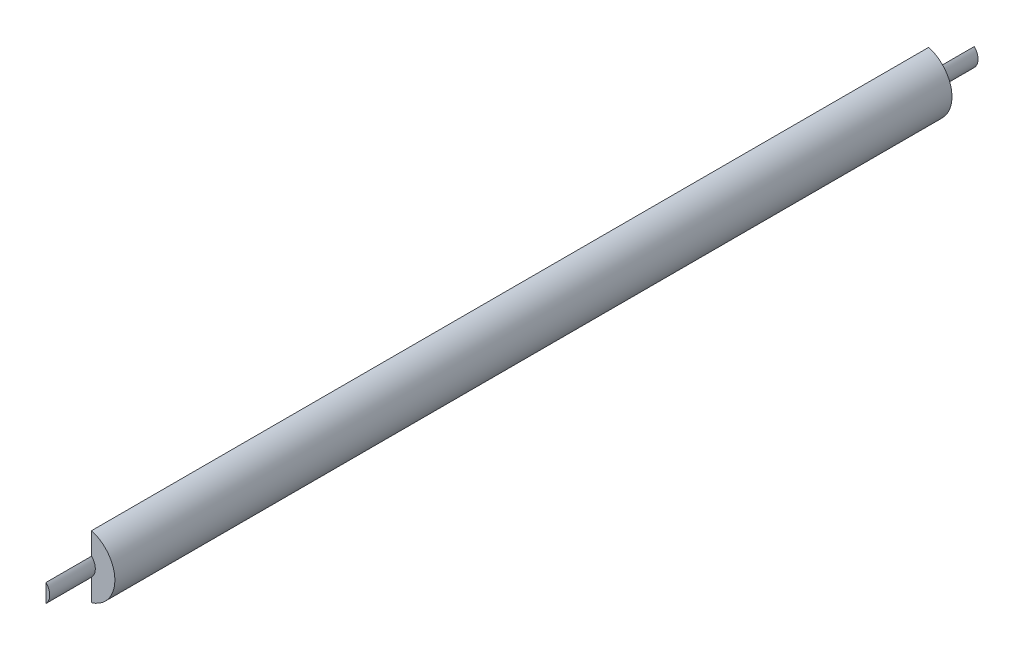
from build123d import *

# Parameters (mm, degrees)
SKIZZE1_R                            = 3.5
AUFSATZ_LINEAR_AUSTRAGEN1_DEPTH      = 90
SKIZZE3_R                            = 1.4
AUFSATZ_LINEAR_AUSTRAGEN2_DEPTH      = 4.9
AUFSATZ_LINEAR_START                 = 4.9
SKIZZE4_R                            = 1.4
AUFSATZ_LINEAR_AUSTRAGEN3_DEPTH      = 4.9
SCHNITT_LINEAR_AUSTRAGEN1_DEPTH      = 96.028995575
SCHNITT_LINEAR_AUSTRAGEN1_DEPTH_BACK = 96.028995575
SKIZZE5_W                            = 2
SKIZZE5_H                            = 8.003816725
SCHNITT_LINEAR_AUSTRAGEN3_DEPTH      = 4.9
SCHNITT_LINEAR_AUSTRAGEN3_DEPTH_BACK = 96.023733877
SKIZZE7_W                            = 3.717932511
SKIZZE7_H                            = 7.916632159


with BuildPart() as part:
    # Skizze1 → Aufsatz-Linear austragen1 (new body)
    with BuildSketch(Plane.XY):
        Circle(SKIZZE1_R)
    extrude(amount=AUFSATZ_LINEAR_AUSTRAGEN1_DEPTH)

    # Skizze3 → Aufsatz-Linear austragen2 (add)
    with BuildSketch(Plane.XY.offset(90)):
        Circle(SKIZZE3_R)
    extrude(amount=AUFSATZ_LINEAR_AUSTRAGEN2_DEPTH)

    # Skizze4 → Aufsatz-Linear austragen3 (add)
    with BuildSketch(Plane(origin=(0, 0, 0), x_dir=(-1, 0, 0), z_dir=(0, 0, -1)).offset(AUFSATZ_LINEAR_START)):
        Circle(SKIZZE4_R)
    extrude(amount=-AUFSATZ_LINEAR_AUSTRAGEN3_DEPTH)

    # Skizze5 → Schnitt-Linear austragen1 (cut, two sides: drawn at the far end of the back side and taken through both)
    with BuildSketch(Plane.XY.offset(90).offset(-SCHNITT_LINEAR_AUSTRAGEN1_DEPTH_BACK)):
        with Locations((0, -0.133552217)):
            Rectangle(SKIZZE5_W, SKIZZE5_H)
    extrude(amount=SCHNITT_LINEAR_AUSTRAGEN1_DEPTH + SCHNITT_LINEAR_AUSTRAGEN1_DEPTH_BACK, mode=Mode.SUBTRACT)


with BuildPart() as schnitt_linear_austragen1_piece_1:
    # of the separate pieces the step leaves, piece 1, a body of its own (schnitt_linear_austragen1_pieces)
    add(part.part.solids().sort_by_distance((-1, 3.354101966, 0))[0])

    # Skizze7 → Schnitt-Linear austragen3 (cut, two sides: drawn at the far end of the back side and taken through both)
    with BuildSketch(Plane.XY.offset(90).offset(-SCHNITT_LINEAR_AUSTRAGEN3_DEPTH_BACK)):
        with Locations((-2.648461898, -0.048076713)):
            Rectangle(SKIZZE7_W, SKIZZE7_H)
    extrude(amount=SCHNITT_LINEAR_AUSTRAGEN3_DEPTH + SCHNITT_LINEAR_AUSTRAGEN3_DEPTH_BACK, mode=Mode.SUBTRACT)


with BuildPart() as schnitt_linear_austragen1_piece_2:
    # of the separate pieces the step leaves, piece 2, a body of its own (schnitt_linear_austragen1_pieces)
    add(part.part.solids().sort_by_distance((1, -3.354101966, 0))[0])


solid = schnitt_linear_austragen1_piece_2.part
